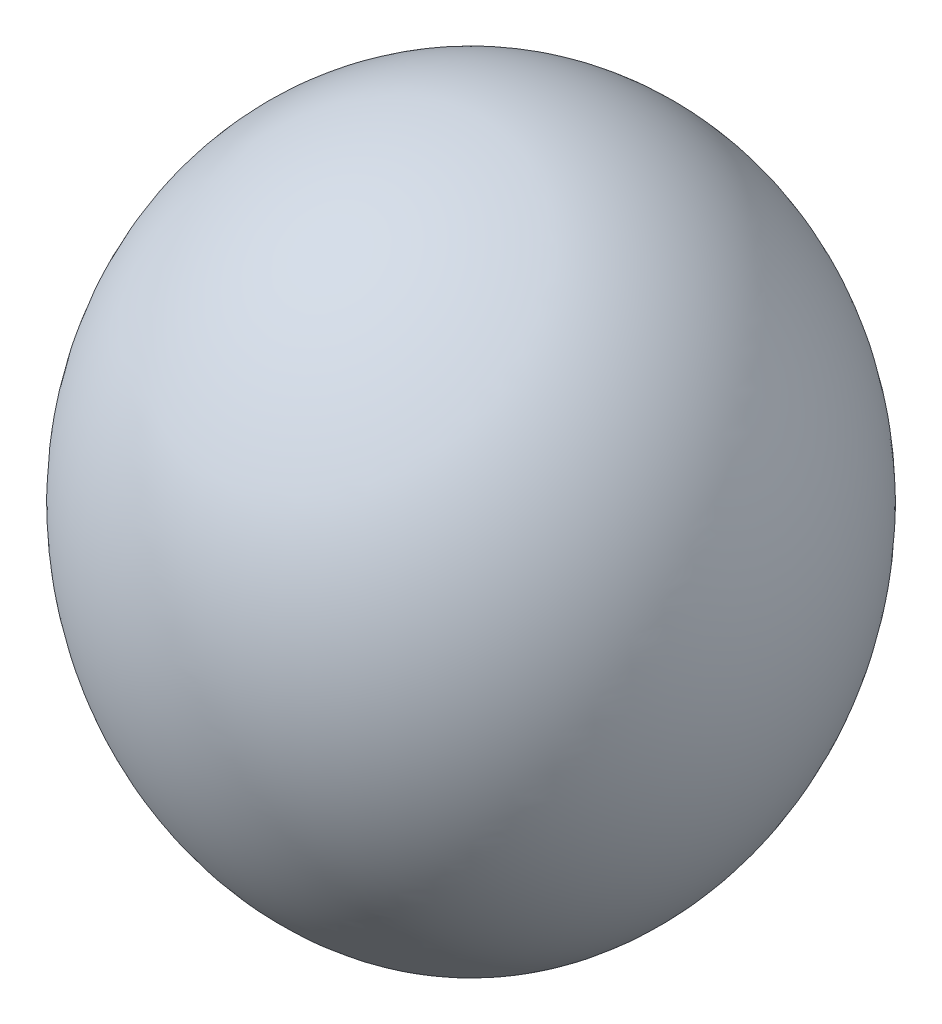
from build123d import *


with BuildPart() as part:
    # Sketch1 → Revolve1 (revolve)
    with BuildSketch(Plane.XY):
        with BuildLine():
            Line((0, 0), (0, 318.309886184))
            add(Edge.make_bspline(
                [(0, 0), (0.085948438, -0.028266268), (0.258741266, -0.081812635), (0.607975906, -0.176773899), (1.136484439, -0.300694334), (1.757360468, -0.425492274), (2.470924874, -0.546444598), (3.187298492, -0.649184207), (3.905812841, -0.735687541), (4.625913711, -0.807603316), (5.766566397, -0.899989175), (7.329971466, -0.978373944), (9.31621461, -1.001536992), (11.722027119, -0.925628511), (14.397171662, -0.737900746), (17.335893263, -0.411989059), (20.530357641, 0.077235569), (23.970799608, 0.753981372), (28.234770062, 1.767568746), (33.28727043, 3.232463379), (39.078025472, 5.269318872), (45.53979496, 7.998823275), (53.11682593, 11.723396245), (61.661117281, 16.6752284), (74.138083632, 25.258238794), (89.492334109, 38.756639471), (105.334527051, 57.210925443), (120.029622868, 81.229498762), (130.843845704, 107.22176629), (137.57074582, 134.558138538), (140.025513533, 162.60594723), (138.301043697, 187.186959394), (133.992044156, 207.830556303), (128.506752773, 224.498756482), (122.986528471, 237.40676996), (116.347205767, 249.777600477), (109.579249052, 260.031141949), (103.11580894, 268.337765834), (96.141356707, 276.213295477), (88.670425521, 283.62750293), (79.671165034, 291.1982061), (69.892744849, 297.935366194), (61.122244154, 302.970615341), (54.405280933, 306.259537853), (49.475227992, 308.4022612), (45.396741543, 310.005002012), (42.100777288, 311.19936152), (38.773905309, 312.304684987), (35.418400717, 313.319846847), (32.036673115, 314.243802659), (28.63105044, 315.075592839), (25.20412399, 315.814346188), (21.758166882, 316.45928305), (18.296095872, 317.009718133), (15.254331625, 317.408144999), (12.640734164, 317.689916768), (10.457900242, 317.884780671), (8.711456829, 318.016662169), (7.017185976, 318.120951146), (5.386172272, 318.200188685), (3.989969436, 318.250002449), (2.861552791, 318.279563874), (1.888399357, 318.296619795), (1.175058966, 318.305716674), (0.523129219, 318.309128091), (0.172957369, 318.309886184), (0, 318.309886184)],
                knots=[0, 0, 0, 0, 0, 0.000700683, 0.001401367, 0.002802733, 0.0042041, 0.005605466, 0.007006833, 0.008408199, 0.009809566, 0.011210932, 0.015870947, 0.020530962, 0.025190977, 0.029850991, 0.036639405, 0.043427819, 0.050216233, 0.057004647, 0.070580987, 0.084157327, 0.097733693, 0.11131006, 0.135947469, 0.160584878, 0.214889816, 0.269194757, 0.323499695, 0.377804649, 0.432109553, 0.486414488, 0.540719416, 0.567871877, 0.595024337, 0.622176787, 0.649329236, 0.676481694, 0.690057923, 0.703634152, 0.730786602, 0.757939052, 0.781003169, 0.795479324, 0.809055556, 0.815843672, 0.822631784, 0.829419895, 0.836208007, 0.842996119, 0.849784231, 0.856572344, 0.863360456, 0.870148569, 0.876936684, 0.883724799, 0.887118856, 0.890512914, 0.893906971, 0.897301029, 0.900248501, 0.903195973, 0.90466971, 0.906143446, 0.907617182, 0.909090918, 0.909090918, 0.909090918, 0.909090918, 0.909090918], degree=4))
        make_face()
    revolve(axis=Axis((0, 318.309886184, 0), (0, -1, 0)))


solid = part.part
